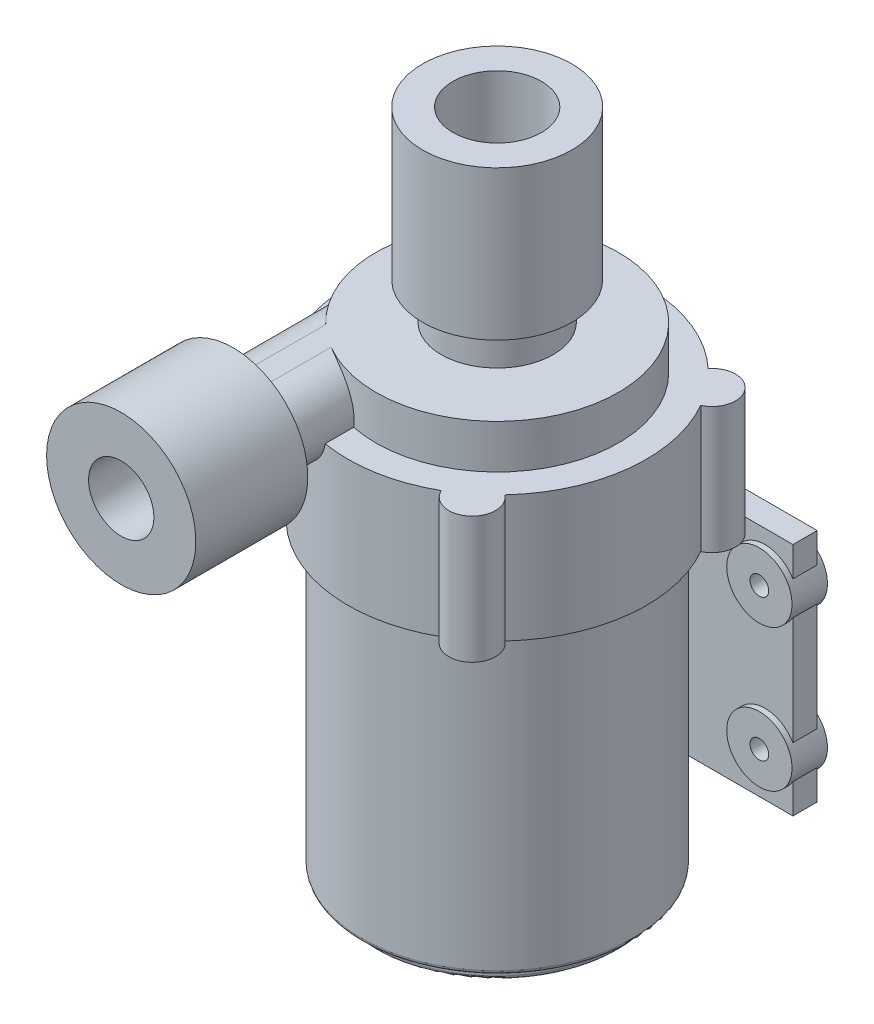
from build123d import *

# Parameters (mm, degrees)
SKETCH1_R            = 18.415
BOSS_EXTRUDE1_DEPTH  = 42.672
SKETCH2_OUTSIDE_W    = 52.296
SKETCH2_OUTSIDE_H    = 52.296
SKETCH2_OUTSIDE_R    = 16.51
CUT_EXTRUDE2_DEPTH   = 1.9431
FILLET1_R            = 0.508
SKETCH3_W            = 45.212
SKETCH3_H            = 32.004
SKETCH3_R            = 1.27
BOSS_EXTRUDE2_DEPTH  = 2.54
SKETCH3_2_W          = 45.212
SKETCH3_2_H          = 32.004
SKETCH3_2_R          = 1.27
BOSS_EXTRUDE3_DEPTH  = 0.762
SKETCH5_R            = 4.445
SKETCH5_R_2          = 1.27
BOSS_EXTRUDE5_DEPTH  = 0.762
BOSS_EXTRUDE8_START  = -4.064
SKETCH5_4_R          = 4.445
SKETCH5_4_R_2        = 1.27
BOSS_EXTRUDE8_DEPTH  = 4.064
BOSS_EXTRUDE9_DEPTH  = 17.2339
SKETCH7_R            = 16.51
BOSS_EXTRUDE10_DEPTH = 5.969
SKETCH8_R            = 7.62
BOSS_EXTRUDE11_DEPTH = 5.08
SKETCH9_R            = 10.16
SKETCH9_R_2          = 6.0325
BOSS_EXTRUDE12_DEPTH = 20.32
BOSS_EXTRUDE13_START = -16.51
BOSS_EXTRUDE13_DEPTH = 16.51
BOSS_EXTRUDE14_DEPTH = 9.525
SKETCH11_R           = 10.16
SKETCH11_R_2         = 4.445
BOSS_EXTRUDE17_DEPTH = 15.24


with BuildPart() as part:
    # Sketch1 → Boss-Extrude1 (new body)
    with BuildSketch(Plane(origin=(0, 0, 0), x_dir=(1, 0, 0), z_dir=(0, 1, 0))):
        with Locations(Location((0, 0, 0), (0, 0, 270))):
            Circle(SKETCH1_R)
    extrude(amount=BOSS_EXTRUDE1_DEPTH)

    # Sketch2 outside → Cut-Extrude2 (cut)
    with BuildSketch(Plane.XZ):
        Rectangle(SKETCH2_OUTSIDE_W, SKETCH2_OUTSIDE_H)
        with Locations(Location((0, 0, 0), (0, 0, 270))):
            Circle(SKETCH2_OUTSIDE_R, mode=Mode.SUBTRACT)
    extrude(amount=-CUT_EXTRUDE2_DEPTH, mode=Mode.SUBTRACT)

    # Fillet1
    fillet1_edges = [part.edges().sort_by_distance(p)[0] for p in [
        (0, 0, 16.51),
        (0, 1.9431, 16.51),
        (0, 1.9431, -18.415),
    ]]
    fillet(fillet1_edges, radius=FILLET1_R)



with BuildPart() as body_2:
    # Sketch3 → Boss-Extrude2 (new body)
    with BuildSketch(Plane(origin=(0, 0, -18.415), x_dir=(-1, 0, 0), z_dir=(0, 0, -1))):
        with Locations((0, 26.162)):
            Rectangle(SKETCH3_W, SKETCH3_H)
        with Locations((-18.796, 35.814)):
            Circle(SKETCH3_R, mode=Mode.SUBTRACT)
        with Locations(Location((-18.796, 16.51, 0), (0, 0, 180))):
            Circle(SKETCH3_R, mode=Mode.SUBTRACT)
        with Locations((18.796, 16.51)):
            Circle(SKETCH3_R, mode=Mode.SUBTRACT)
        with Locations(Location((18.796, 35.814, 0), (0, 0, 180))):
            Circle(SKETCH3_R, mode=Mode.SUBTRACT)
    extrude(amount=BOSS_EXTRUDE2_DEPTH)


with BuildPart() as part_1:
    add(part.part)

    add(body_2.part)  # Boss-Extrude3 merges body 2
    # Sketch3<2> → Boss-Extrude3 (add)
    with BuildSketch(Plane(origin=(0, 0, -18.415), x_dir=(-1, 0, 0), z_dir=(0, 0, -1))):
        with Locations((0, 26.162)):
            Rectangle(SKETCH3_2_W, SKETCH3_2_H)
        with Locations((-18.796, 35.814)):
            Circle(SKETCH3_2_R, mode=Mode.SUBTRACT)
        with Locations((-18.796, 16.51)):
            Circle(SKETCH3_2_R, mode=Mode.SUBTRACT)
        with Locations((18.796, 16.51)):
            Circle(SKETCH3_2_R, mode=Mode.SUBTRACT)
        with Locations((18.796, 35.814)):
            Circle(SKETCH3_2_R, mode=Mode.SUBTRACT)
    extrude(amount=-BOSS_EXTRUDE3_DEPTH)

    # Sketch5 → Boss-Extrude5 (add)
    # profile 1 of 4: a face of its own
    with BuildSketch(Plane(origin=(0, 0, -20.955), x_dir=(-1, 0, 0), z_dir=(0, 0, -1))):
        with Locations(Location((-18.796, 35.814, 0), (0, 0, 211.002719134))):
            Circle(SKETCH5_R)
        with Locations((-18.796, 35.814)):
            Circle(SKETCH5_R_2, mode=Mode.SUBTRACT)
    # profile 2 of 4: a face of its own
    with BuildSketch(Plane(origin=(0, 0, -20.955), x_dir=(-1, 0, 0), z_dir=(0, 0, -1))):
        with Locations(Location((-18.796, 16.51, 0), (0, 0, 211.002719134))):
            Circle(SKETCH5_R)
        with Locations((-18.796, 16.51)):
            Circle(SKETCH5_R_2, mode=Mode.SUBTRACT)
    # profile 3 of 4: a face of its own
    with BuildSketch(Plane(origin=(0, 0, -20.955), x_dir=(-1, 0, 0), z_dir=(0, 0, -1))):
        with Locations(Location((18.796, 16.51, 0), (0, 0, 180))):
            Circle(SKETCH5_R)
        with Locations((18.796, 16.51)):
            Circle(SKETCH5_R_2, mode=Mode.SUBTRACT)
    # profile 4 of 4: a face of its own
    with BuildSketch(Plane(origin=(0, 0, -20.955), x_dir=(-1, 0, 0), z_dir=(0, 0, -1))):
        with Locations(Location((18.796, 35.814, 0), (0, 0, 180))):
            Circle(SKETCH5_R)
        with Locations((18.796, 35.814)):
            Circle(SKETCH5_R_2, mode=Mode.SUBTRACT)
    extrude(amount=BOSS_EXTRUDE5_DEPTH)

    # Sketch5<4> → Boss-Extrude8 (add)
    # profile 1 of 4: a face of its own
    with BuildSketch(Plane(origin=(0, 0, -20.955), x_dir=(-1, 0, 0), z_dir=(0, 0, -1)).offset(BOSS_EXTRUDE8_START)):
        with Locations((-18.796, 35.814)):
            Circle(SKETCH5_4_R)
        with Locations((-18.796, 35.814)):
            Circle(SKETCH5_4_R_2, mode=Mode.SUBTRACT)
    # profile 2 of 4: a face of its own
    with BuildSketch(Plane(origin=(0, 0, -20.955), x_dir=(-1, 0, 0), z_dir=(0, 0, -1)).offset(BOSS_EXTRUDE8_START)):
        with Locations((-18.796, 16.51)):
            Circle(SKETCH5_4_R)
        with Locations((-18.796, 16.51)):
            Circle(SKETCH5_4_R_2, mode=Mode.SUBTRACT)
    # profile 3 of 4: a face of its own
    with BuildSketch(Plane(origin=(0, 0, -20.955), x_dir=(-1, 0, 0), z_dir=(0, 0, -1)).offset(BOSS_EXTRUDE8_START)):
        with Locations(Location((18.796, 16.51, 0), (0, 0, 180))):
            Circle(SKETCH5_4_R)
        with Locations((18.796, 16.51)):
            Circle(SKETCH5_4_R_2, mode=Mode.SUBTRACT)
    # profile 4 of 4: a face of its own
    with BuildSketch(Plane(origin=(0, 0, -20.955), x_dir=(-1, 0, 0), z_dir=(0, 0, -1)).offset(BOSS_EXTRUDE8_START)):
        with Locations(Location((18.796, 35.814, 0), (0, 0, 180))):
            Circle(SKETCH5_4_R)
        with Locations((18.796, 35.814)):
            Circle(SKETCH5_4_R_2, mode=Mode.SUBTRACT)
    extrude(amount=BOSS_EXTRUDE8_DEPTH)

    # Sketch6 → Boss-Extrude9 (add)
    with BuildSketch(Plane(origin=(0, 42.672, 0), x_dir=(1, 0, 0), z_dir=(0, 1, 0))):
        with BuildLine():
            ThreePointArc((-14.885846945, 13.831628998), (-20.183913314, 2.347774127), (-17.663218531, -10.045551809))
            ThreePointArc((-17.663218531, -10.045551809), (-18.820039984, -14.897989932), (-13.831628998, -14.885846945))
            ThreePointArc((-13.831628998, -14.885846945), (-2.347774127, -20.183913314), (10.045551809, -17.663218531))
            ThreePointArc((10.045551809, -17.663218531), (14.897989932, -18.820039984), (14.885846945, -13.831628998))
            ThreePointArc((14.885846945, -13.831628998), (20.183913314, -2.347774127), (17.663218531, 10.045551809))
            ThreePointArc((17.663218531, 10.045551809), (18.820039984, 14.897989932), (13.831628998, 14.885846945))
            ThreePointArc((13.831628998, 14.885846945), (2.347774127, 20.183913314), (-10.045551809, 17.663218531))
            ThreePointArc((-10.045551809, 17.663218531), (-14.897989932, 18.820039984), (-14.885846945, 13.831628998))
        make_face()
    extrude(amount=BOSS_EXTRUDE9_DEPTH)

    # Sketch7 → Boss-Extrude10 (add)
    with BuildSketch(Plane(origin=(0, 59.9059, 0), x_dir=(1, 0, 0), z_dir=(0, 1, 0))):
        with Locations(Location((0, 0, 0), (0, 0, 90))):
            Circle(SKETCH7_R)
    extrude(amount=BOSS_EXTRUDE10_DEPTH)

    # Sketch8 → Boss-Extrude11 (add)
    with BuildSketch(Plane(origin=(0, 65.8749, 0), x_dir=(1, 0, 0), z_dir=(0, 1, 0))):
        with Locations(Location((0, 0, 0), (0, 0, 270))):
            Circle(SKETCH8_R)
    extrude(amount=BOSS_EXTRUDE11_DEPTH)

    # Sketch9 → Boss-Extrude12 (add)
    with BuildSketch(Plane(origin=(0, 70.9549, 0), x_dir=(1, 0, 0), z_dir=(0, 1, 0))):
        with Locations(Location((0, 0, 0), (0, 0, 270))):
            Circle(SKETCH9_R)
        with Locations(Location((0, 0, 0), (0, 0, 270))):
            Circle(SKETCH9_R_2, mode=Mode.SUBTRACT)
    extrude(amount=BOSS_EXTRUDE12_DEPTH)

    # Sketch10 → Boss-Extrude13 (add)
    with BuildSketch(Plane.XY.offset(16.51).offset(BOSS_EXTRUDE13_START)):
        with BuildLine():
            Line((-8.382, 65.8749), (-11.43, 65.8749))
            ThreePointArc((-11.43, 65.8749), (-16.51, 60.7949), (-11.43, 55.7149))
            Line((-11.43, 55.7149), (-8.382, 55.7149))
            ThreePointArc((-8.382, 55.7149), (-3.302, 60.7949), (-8.382, 65.8749))
        make_face()
    extrude(amount=BOSS_EXTRUDE13_DEPTH)

    # Sketch10<2> → Boss-Extrude14 (add)
    with BuildSketch(Plane.XY.offset(16.51)):
        with BuildLine():
            Line((-11.43, 65.8749), (-8.382, 65.8749))
            ThreePointArc((-8.382, 65.8749), (-3.302, 60.7949), (-8.382, 55.7149))
            Line((-8.382, 55.7149), (-11.43, 55.7149))
            ThreePointArc((-11.43, 55.7149), (-16.51, 60.7949), (-11.43, 65.8749))
        make_face()
    extrude(amount=BOSS_EXTRUDE14_DEPTH)

    # Sketch11 → Boss-Extrude17 (add)
    with BuildSketch(Plane.XY.offset(26.035)):
        with Locations(Location((-9.906, 60.7949, 0), (0, 0, 180))):
            Circle(SKETCH11_R)
        with Locations(Location((-9.906, 60.7949, 0), (0, 0, 180))):
            Circle(SKETCH11_R_2, mode=Mode.SUBTRACT)
    extrude(amount=BOSS_EXTRUDE17_DEPTH)


solid = part_1.part
